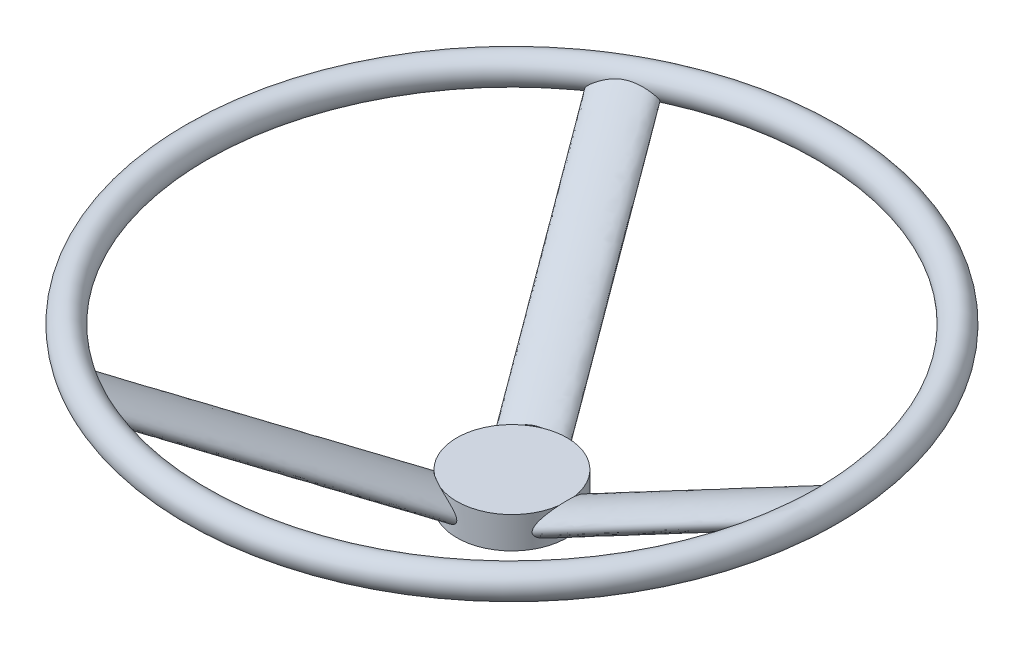
from build123d import *
from build123d.topology import SkipClean

# Parameters (mm, degrees)
SKETCH1_R                = 13.75
SKETCH1_W                = 52.5
SKETCH1_H                = 30
BOSS_EXTRUDE1_REACH      = 707.294
BOSS_EXTRUDE1_END_RADIUS = 52.5
SKETCH3_RX               = 26.25
SKETCH3_RY               = 11.25
CIRPATTERN1_COUNT        = 3


with BuildPart() as part:
    # Sketch1 → Revolve1 (revolve)
    with BuildSketch(Plane.XY, mode=Mode.PRIVATE) as revolve1_sk:
        with Locations((300, 150)):
            Circle(SKETCH1_R)
        with Locations((26.25, 15)):
            Rectangle(SKETCH1_W, SKETCH1_H)
    revolve(revolve1_sk.sketch.rotate(Axis((0, 0, 0), (0, 1, 0)), 90), axis=Axis((0, 0, 0), (0, 1, 0)))

    # Boss-Extrude1: up to this cylinder (the profile starts outside it)
    boss_extrude1_end = Plane(origin=(0, 149.387624, 0), z_dir=(0, -1, 0)) * Cylinder(BOSS_EXTRUDE1_END_RADIUS, 1520.588, mode=Mode.PRIVATE)
    # Sketch3 → Boss-Extrude1 (add, up to the surface)
    with BuildSketch(Plane(origin=(300, 149.368122083, 0), x_dir=(0, 0, 1), z_dir=(-0.8832875558524117, -0.46883162614767443, 0)), mode=Mode.PRIVATE) as boss_extrude1_sk1:
        with Locations((0, 0.022078806)):
            Ellipse(SKETCH3_RX, SKETCH3_RY)
    boss_extrude1_tool1 = extrude(boss_extrude1_sk1.sketch, amount=BOSS_EXTRUDE1_REACH, mode=Mode.PRIVATE) - boss_extrude1_end
    boss_extrude1 = boss_extrude1_tool1.solids().sort_by_distance((299.989649, 149.387624, 0))[0]
    add(boss_extrude1)

    # CirPattern1: Boss-Extrude1 ×3 about axis
    with SkipClean():  # the faces are left unmerged after this step: merging them gives an invalid solid
        cirpattern1_axis = Axis((0, 0, 0), (0, -1, 0))
        for i in range(1, CIRPATTERN1_COUNT):
            add(boss_extrude1.rotate(cirpattern1_axis, i * 360 / CIRPATTERN1_COUNT))


solid = part.part
